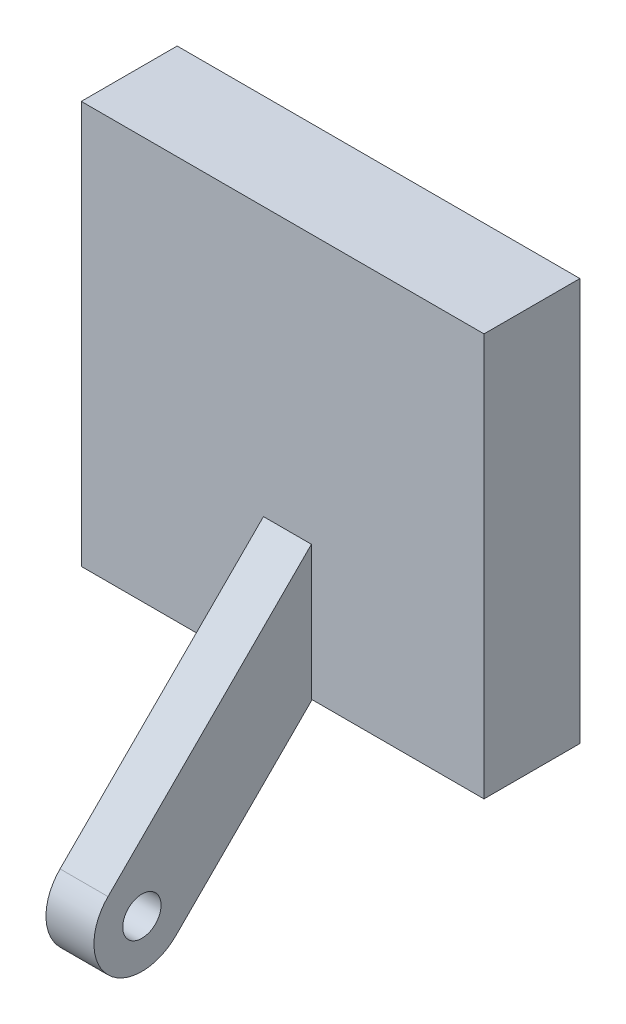
from build123d import *

# Parameters (mm, degrees)
CROQUIS1_R                    = 2
SALIENTE_EXTRUIR9_DEPTH       = 5
SALIENTE_EXTRUIR10_DEPTH      = 18
SALIENTE_EXTRUIR10_DEPTH_BACK = 24
CROQUIS7_W                    = 10
CROQUIS7_H                    = 42


with BuildPart() as part:
    # Croquis1 → Saliente-Extruir9 (new body)
    with BuildSketch(Plane(origin=(0, 0, 0), x_dir=(0, 0, -1), z_dir=(1, 0, 0))):
        with BuildLine():
            Line((0, 0), (21.213203436, 21.213203436))
            Line((21.213203436, 21.213203436), (14.142135624, 28.284271247))
            Line((14.142135624, 28.284271247), (-7.071067812, 7.071067812))
            ThreePointArc((-7.071067812, 7.071067812), (-7.071067812, 0), (0, 0))
        make_face()
        with Locations((-3.535533906, 3.535533906)):
            Circle(CROQUIS1_R, mode=Mode.SUBTRACT)
    extrude(amount=SALIENTE_EXTRUIR9_DEPTH)

    # Croquis7 → Saliente-Extruir10 (add, two sides: drawn at the far end of the back side and taken through both)
    with BuildSketch(Plane(origin=(5, 0, 0), x_dir=(0, 0, -1), z_dir=(1, 0, 0)).offset(-SALIENTE_EXTRUIR10_DEPTH_BACK)):
        with Locations((19.142135624, 35.284271247)):
            Rectangle(CROQUIS7_W, CROQUIS7_H)
    extrude(amount=SALIENTE_EXTRUIR10_DEPTH + SALIENTE_EXTRUIR10_DEPTH_BACK)


solid = part.part
